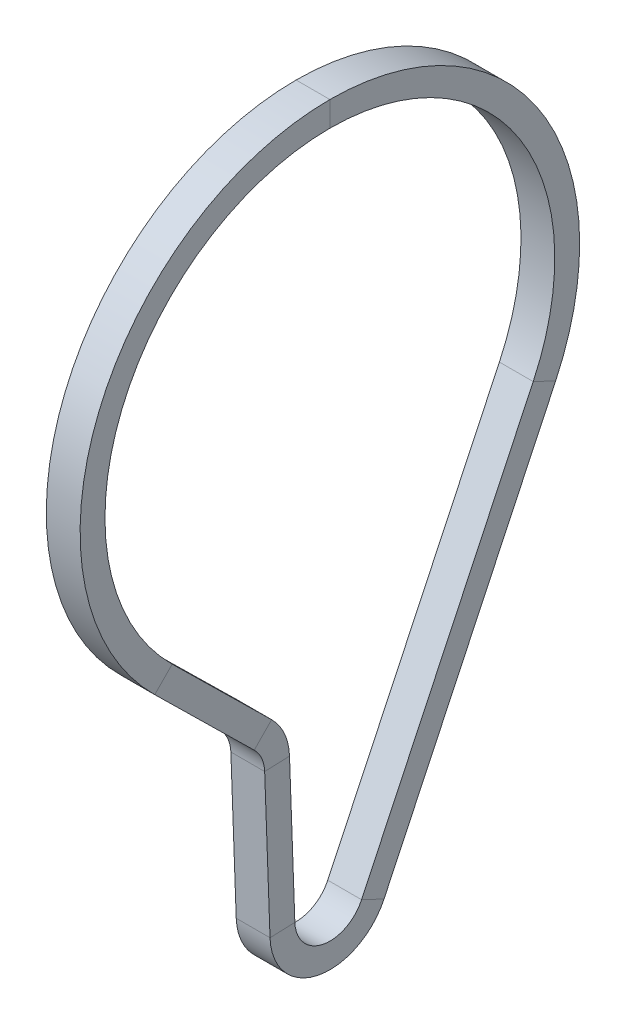
from build123d import *

# Parameters (mm, degrees)
SKETCH2_W = 12.954
SKETCH2_H = 9.525


with BuildPart() as part:
    # Sweep1: sweep along a path in Sketch1
    with BuildLine(Plane(origin=(0, 0, 0), x_dir=(0, 0, -1), z_dir=(1, 0, 0))) as sweep1_path:
        Line((16.44462174, -177.958291165), (82.2231087, -38.891455826))
        ThreePointArc((82.2231087, -38.891455826), (-15.927353777, 89.551685312), (-63.770693422, -64.857409762))
        Line((-63.770693422, -64.857409762), (-25.655266105, -102.334195206))
        ThreePointArc((-25.655266105, -102.334195206), (-21.763323864, -107.968416943), (-20.230093904, -114.642311973))
        Line((-20.230093904, -114.642311973), (-18.179310885, -170.843365185))
        ThreePointArc((-18.179310885, -170.843365185), (-3.66167032, -187.999078767), (16.44462174, -177.958291165))
    # Sketch2 → Sweep1 (sweep)
    with BuildSketch(Plane.XY):
        with Locations((0, 90.957049977)):
            Rectangle(SKETCH2_W, SKETCH2_H)
    sweep(path=sweep1_path.line)


solid = part.part
